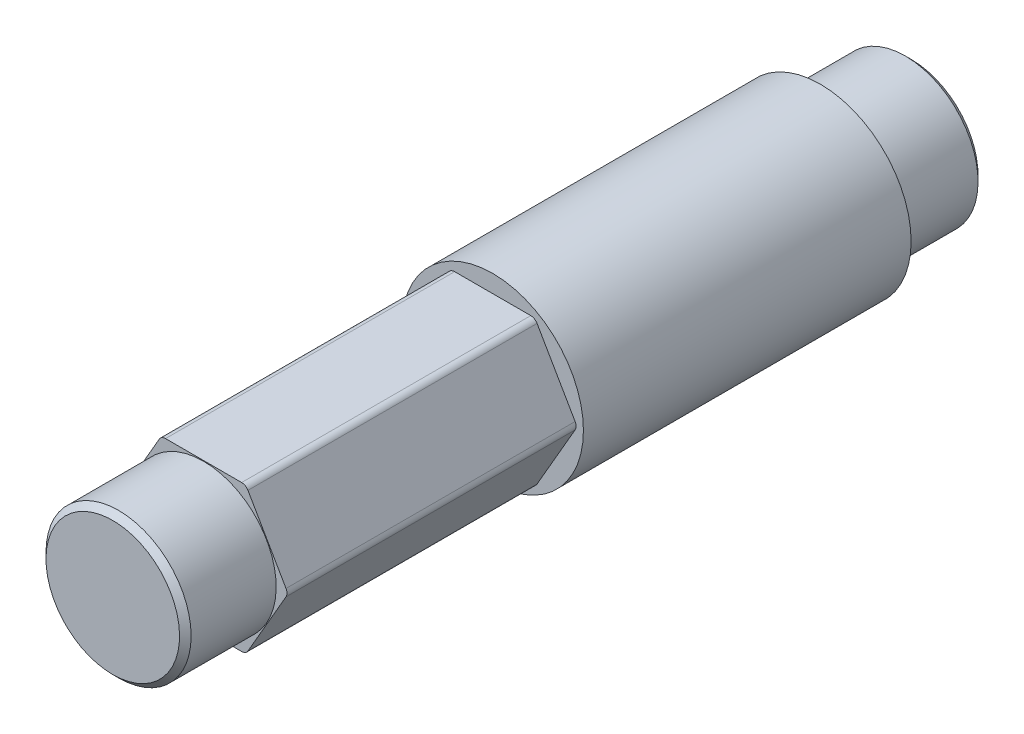
from build123d import *

# Parameters (mm, degrees)
SKETCH2_OUTSIDE_W  = 32.552
SKETCH2_OUTSIDE_H  = 32.553
CUT_EXTRUDE1_DEPTH = 25.2984
CHAMFER1_SIZE      = 0.508
FILLET1_R          = 0.635


with BuildPart() as part:
    # Sketch1 → Revolve1 (revolve)
    with BuildSketch(Plane(origin=(0, 0, 0), x_dir=(0, 0, -1), z_dir=(1, 0, 0))):
        Polygon((0, 0), (0, 6.35), (7.9502, 6.35), (7.9502, 7.62), (33.2486, 7.62), (33.2486, 7.9375), (61.9252, 7.9375), (61.9252, 6.35), (69.8754, 6.35), (69.8754, 0), align=None)
    revolve(axis=Axis((0, 0, 0), (0, 0, 1)))

    # Sketch2 outside → Cut-Extrude1 (cut)
    with BuildSketch(Plane.XY.offset(-7.9502)):
        with Locations((0, 0.0005)):
            Rectangle(SKETCH2_OUTSIDE_W, SKETCH2_OUTSIDE_H)
        Polygon((3.696970073, 6.40334), (-3.696970073, 6.40334), (-7.393940145, 0), (-3.696970073, -6.40334), (3.696970073, -6.40334), (7.393940145, 0), align=None, mode=Mode.SUBTRACT)
    extrude(amount=-CUT_EXTRUDE1_DEPTH, mode=Mode.SUBTRACT)

    # Chamfer1
    chamfer1_edges = [part.edges().sort_by_distance(p)[0] for p in [
        (0, -6.35, 0),
        (0, -6.35, -69.8754),
    ]]
    chamfer(chamfer1_edges, length=CHAMFER1_SIZE)

    # Fillet1
    fillet1_edges = [part.edges().sort_by_distance(p)[0] for p in [
        (3.696970073, 6.40334, -20.5994),
        (-3.696970073, 6.40334, -20.5994),
        (-7.393940145, 0, -20.5994),
        (-3.696970073, -6.40334, -20.5994),
        (3.696970073, -6.40334, -20.5994),
        (7.393940145, 0, -20.5994),
    ]]
    fillet(fillet1_edges, radius=FILLET1_R)


solid = part.part
